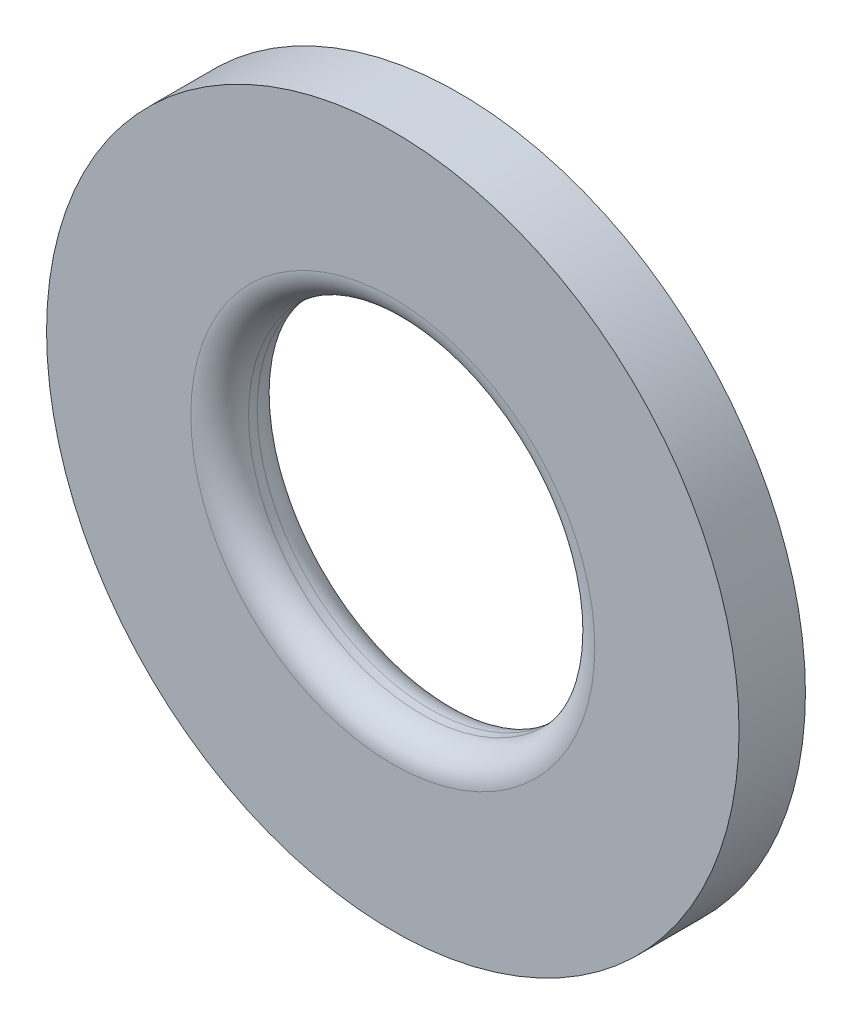
from build123d import *

# Parameters (mm, degrees)
SKETCH_1_R      = 12
SKETCH_1_R_2    = 6
EXTRUDE_1_DEPTH = 2.3
FILLET_1_R      = 1


with BuildPart() as part:
    # 草图1 → 凸台-拉伸1 (new body)
    with BuildSketch(Plane.XY):
        Circle(SKETCH_1_R)
        Circle(SKETCH_1_R_2, mode=Mode.SUBTRACT)
    extrude(amount=EXTRUDE_1_DEPTH)

    # 圆角1
    fillet_1_edges = [part.edges().sort_by_distance(p)[0] for p in [
        (-6, 0, 0),
        (-6, 0, 2.3),
    ]]
    fillet(fillet_1_edges, radius=FILLET_1_R)


solid = part.part
